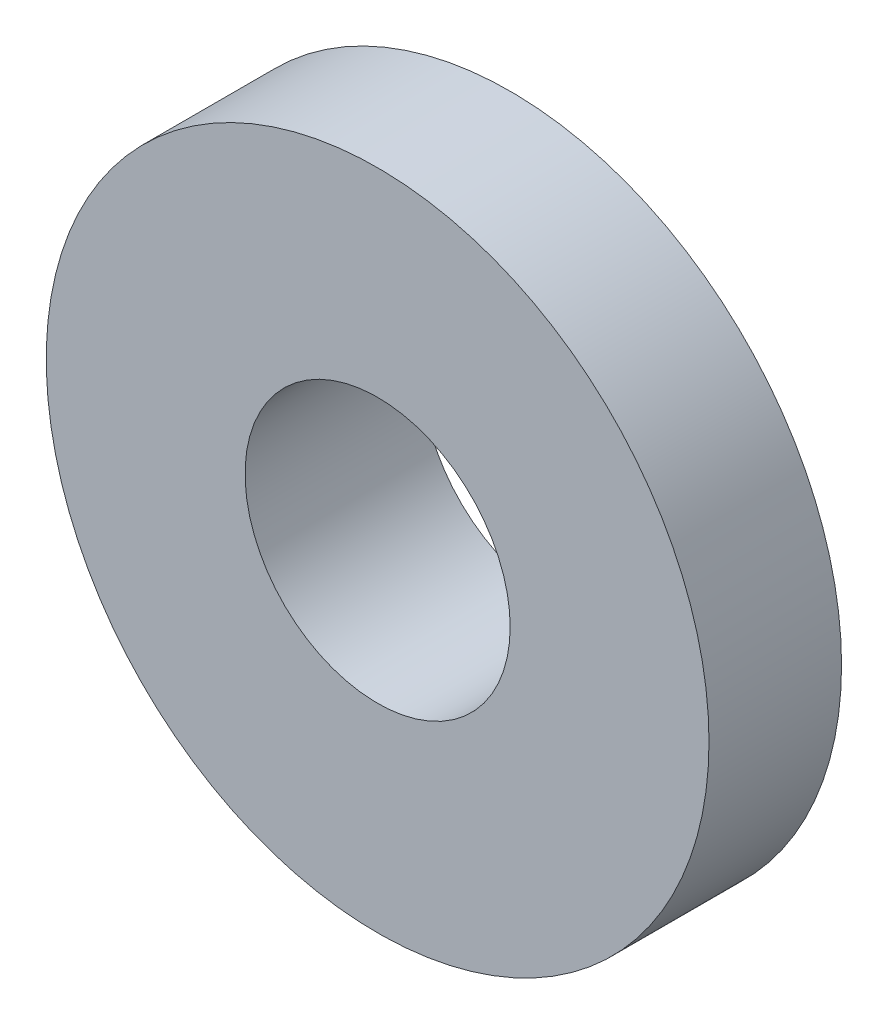
from build123d import *

# Parameters (mm, degrees)
ESQUISSE1_R        = 3.75
ESQUISSE1_R_2      = 1.5
BOSS_EXTRU_1_DEPTH = 1.5
BOSS_EXTRU_2_START = -0.5
ESQUISSE1_3_R      = 2.5
ESQUISSE1_3_R_2    = 1.5
BOSS_EXTRU_2_DEPTH = 0.5


with BuildPart() as part:
    # Esquisse1 → Boss.-Extru.1 (new body)
    with BuildSketch(Plane.XY):
        Circle(ESQUISSE1_R)
        Circle(ESQUISSE1_R_2, mode=Mode.SUBTRACT)
    extrude(amount=BOSS_EXTRU_1_DEPTH)

    # Esquisse1<3> → Boss.-Extru.2 (add)
    with BuildSketch(Plane.XY.offset(BOSS_EXTRU_2_START)):
        Circle(ESQUISSE1_3_R)
        Circle(ESQUISSE1_3_R_2, mode=Mode.SUBTRACT)
    extrude(amount=BOSS_EXTRU_2_DEPTH)


solid = part.part
